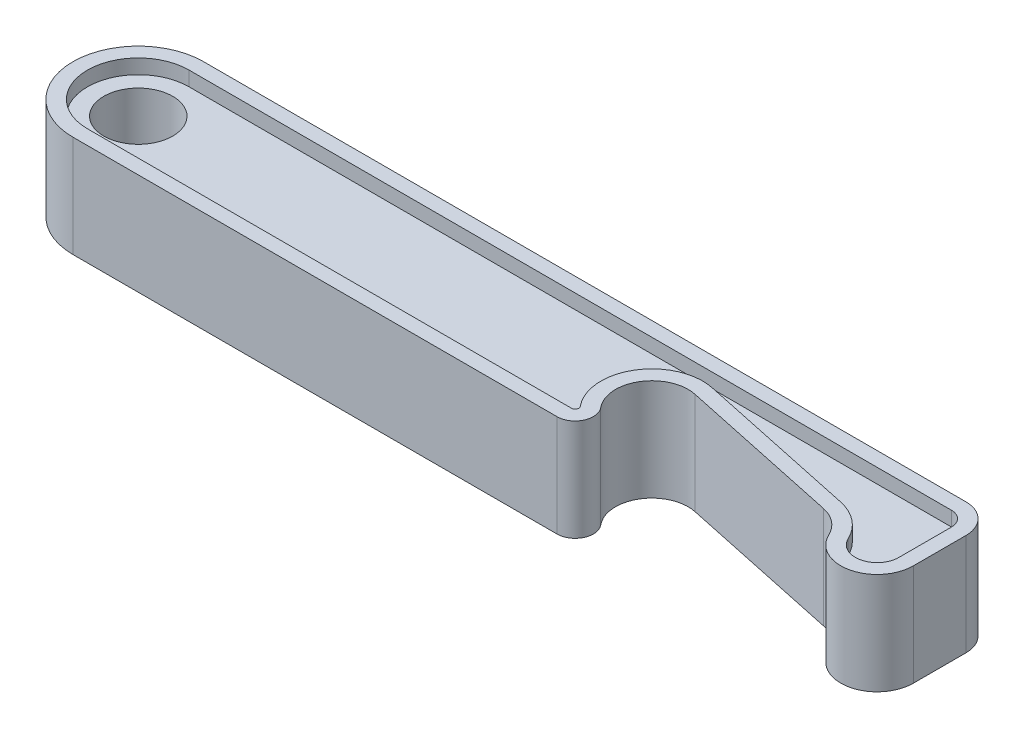
from build123d import *

# Parameters (mm, degrees)
BOSS_EXTRUDE1_DEPTH = 7
SKETCH1_4_R         = 4.75
BOSS_EXTRUDE2_DEPTH = 5


with BuildPart() as part:
    # Sketch1 → Boss-Extrude1 (new, symmetric)
    with BuildSketch(Plane(origin=(0, 0, 0), x_dir=(1, 0, 0), z_dir=(0, 1, 0))):
        with BuildLine():
            Line((55, 9), (-50, 9))
            ThreePointArc((-50, 9), (-59, 0), (-50, -9))
            Line((-50, -9), (16.670970527, -9))
            ThreePointArc((16.670970527, -9), (18.933207864, -7.564087513), (18.596745327, -4.905825787))
            ThreePointArc((18.596745327, -4.905825787), (18.171060665, 0.871975682), (23.487853381, 3.173260641))
            Line((23.487853381, 3.173260641), (45.987853381, -1.609261996))
            ThreePointArc((45.987853381, -1.609261996), (48.055615348, -2.58278673), (49.474147464, -4.374756762))
            ThreePointArc((49.474147464, -4.374756762), (55.08874637, -7.129537228), (59, -2.249513525))
            Line((59, -2.249513525), (59, 5))
            ThreePointArc((59, 5), (57.828427125, 7.828427125), (55, 9))
        make_face()
        with BuildLine():
            ThreePointArc((-50, -7), (-57, 0), (-50, 7))
            Line((-50, 7), (55, 7))
            ThreePointArc((55, 7), (56.414213562, 6.414213562), (57, 5))
            Line((57, 5), (57, -2.249513525))
            ThreePointArc((57, -2.249513525), (54.653247822, -5.177527747), (51.284488478, -3.524659467))
            ThreePointArc((51.284488478, -3.524659467), (49.298543517, -1.015901422), (46.403676763, 0.347033205))
            Line((46.403676763, 0.347033205), (23.903676763, 5.129555843))
            ThreePointArc((23.903676763, 5.129555843), (16.46016696, 1.9077569), (17.056125487, -6.181165157))
            ThreePointArc((17.056125487, -6.181165157), (17.123417995, -6.712817503), (16.670970527, -7))
            Line((16.670970527, -7), (-50, -7))
        make_face(mode=Mode.SUBTRACT)
    extrude(amount=BOSS_EXTRUDE1_DEPTH, both=True)

    # Sketch1<4> → Boss-Extrude2 (add, symmetric)
    with BuildSketch(Plane(origin=(0, 0, 0), x_dir=(1, 0, 0), z_dir=(0, 1, 0))):
        with BuildLine():
            Line((55, 7), (-50, 7))
            ThreePointArc((-50, 7), (-57, 0), (-50, -7))
            Line((-50, -7), (16.670970527, -7))
            ThreePointArc((16.670970527, -7), (17.123417995, -6.712817503), (17.056125487, -6.181165157))
            ThreePointArc((17.056125487, -6.181165157), (16.46016696, 1.9077569), (23.903676763, 5.129555843))
            Line((23.903676763, 5.129555843), (46.403676763, 0.347033205))
            ThreePointArc((46.403676763, 0.347033205), (49.298543517, -1.015901422), (51.284488478, -3.524659467))
            ThreePointArc((51.284488478, -3.524659467), (54.653247822, -5.177527747), (57, -2.249513525))
            Line((57, -2.249513525), (57, 5))
            ThreePointArc((57, 5), (56.414213562, 6.414213562), (55, 7))
        make_face()
        with Locations((-50, 0)):
            Circle(SKETCH1_4_R, mode=Mode.SUBTRACT)
    extrude(amount=BOSS_EXTRUDE2_DEPTH, both=True)


solid = part.part
